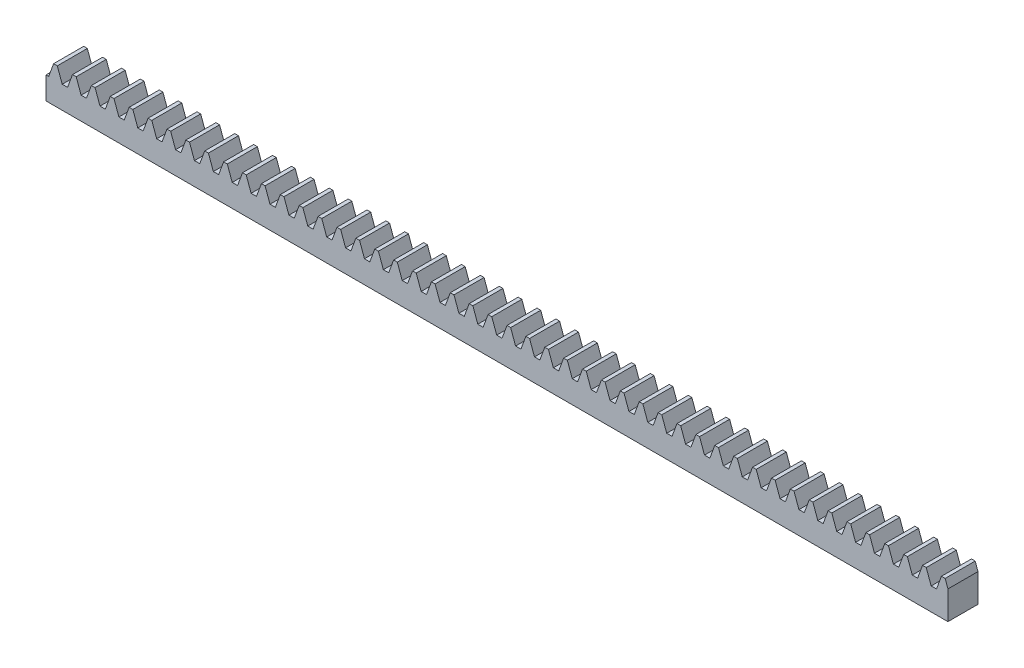
from build123d import *

# Parameters (mm, degrees)
BLANKSKE_W        = 150
BLANKSKE_H        = 6
BLANK_DEPTH       = 5
TOOTHCUTSIM_DEPTH = 151.203195705
TEETHCUTS_COUNT   = 49
TEETHCUTS_PITCH   = 3.14159265


with BuildPart() as part:
    # BlankSke → Blank (new body)
    with BuildSketch(Plane.XY):
        with Locations((75, 3)):
            Rectangle(BLANKSKE_W, BLANKSKE_H)
    extrude(amount=-BLANK_DEPTH)

    # TooCutSkeSim → ToothCutSim (cut, through all)
    with BuildSketch(Plane.XY):
        Polygon((0.44443537, 3.75), (-0.44443537, 3.75), (-1.272613241, 6.0254), (1.272613241, 6.0254), align=None)
    toothcutsim = extrude(amount=-TOOTHCUTSIM_DEPTH, mode=Mode.SUBTRACT)

    # TeethCuts: ToothCutSim ×49
    with Locations(*[(i * TEETHCUTS_PITCH, 0, 0) for i in range(1, TEETHCUTS_COUNT)]):
        add(toothcutsim, mode=Mode.SUBTRACT)


solid = part.part
